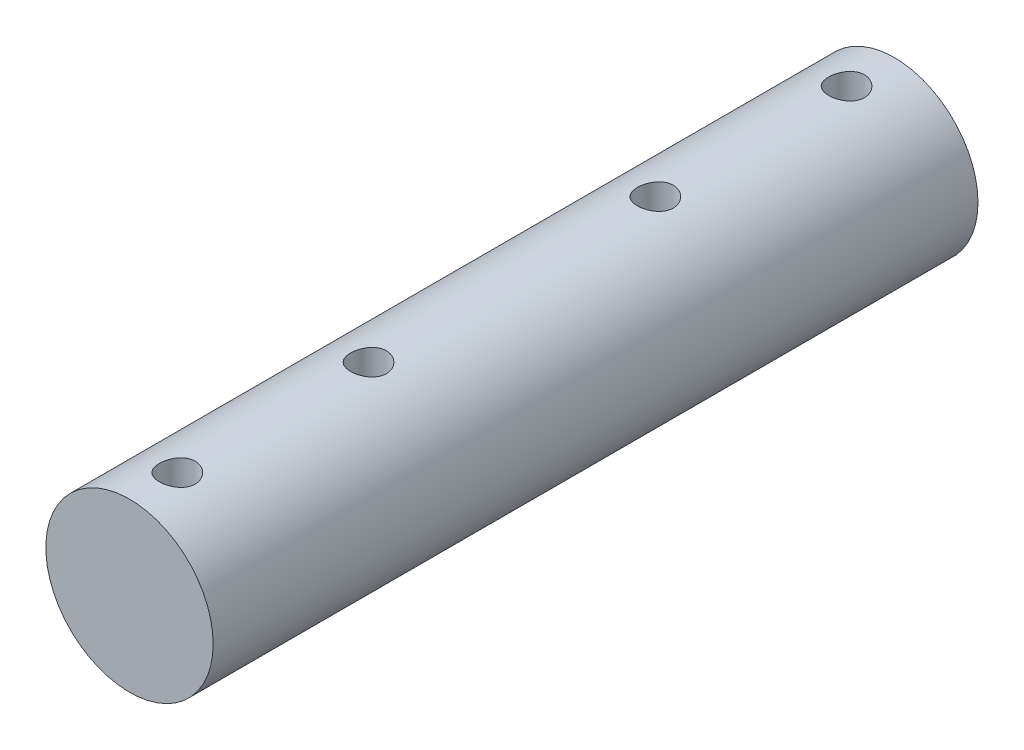
from build123d import *

# Parameters (mm, degrees)
SKETCH1_R               = 22.225
BOSS_EXTRUDE1_DEPTH     = 203.2
CUT_EXTRUDE1_DEPTH      = 203.2
CUT_EXTRUDE1_DEPTH_BACK = 203.2
SKETCH2_R               = 4.7625


with BuildPart() as part:
    # Sketch1 → Boss-Extrude1 (new body)
    with BuildSketch(Plane.XY):
        Circle(SKETCH1_R)
    extrude(amount=BOSS_EXTRUDE1_DEPTH)

    # Sketch2 → Cut-Extrude1 (cut, two sides: drawn at the far end of the back side and taken through both)
    with BuildSketch(Plane(origin=(0, 0, 0), x_dir=(1, 0, 0), z_dir=(0, 1, 0)).offset(-CUT_EXTRUDE1_DEPTH_BACK)):
        with Locations((0, -190.5)):
            Circle(SKETCH2_R)
        with Locations((0, -139.7)):
            Circle(SKETCH2_R)
        with Locations((0, -12.7)):
            Circle(SKETCH2_R)
        with Locations((0, -63.5)):
            Circle(SKETCH2_R)
    extrude(amount=CUT_EXTRUDE1_DEPTH + CUT_EXTRUDE1_DEPTH_BACK, mode=Mode.SUBTRACT)


solid = part.part
